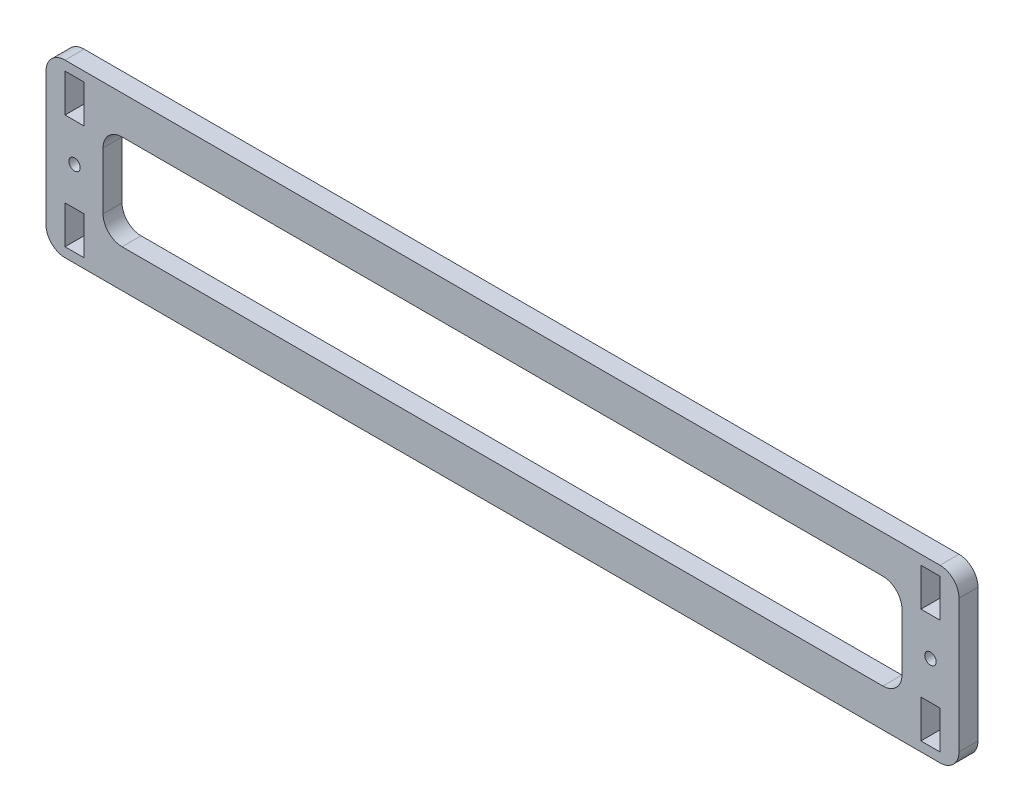
from build123d import *

# Parameters (mm, degrees)
SKETCH1_W               = 240
SKETCH1_H               = 45
SKETCH1_R               = 1.5
SKETCH1_W_2             = 5
SKETCH1_H_2             = 10
BOSS_EXTRUDE1_DEPTH     = 5
ESQUISSE1_W             = 210
ESQUISSE1_H             = 25
ENL_V_MAT_EXTRU_1_DEPTH = 10
CONG_1_R                = 5


with BuildPart() as part:
    # Sketch1 → Boss-Extrude1 (new body)
    with BuildSketch(Plane.XY):
        with Locations((34.186746988, 0)):
            Rectangle(SKETCH1_W, SKETCH1_H)
        with Locations((-78.313253012, 0)):
            Circle(SKETCH1_R, mode=Mode.SUBTRACT)
        with Locations(Location((146.686746988, 0, 0), (0, 0, 180))):
            Circle(SKETCH1_R, mode=Mode.SUBTRACT)
        with Locations((-78.313253012, -15)):
            Rectangle(SKETCH1_W_2, SKETCH1_H_2, mode=Mode.SUBTRACT)
        with Locations((-78.313253012, 15)):
            Rectangle(SKETCH1_W_2, SKETCH1_H_2, mode=Mode.SUBTRACT)
        with Locations((146.686746988, -15)):
            Rectangle(SKETCH1_W_2, SKETCH1_H_2, mode=Mode.SUBTRACT)
        with Locations((146.686746988, 15)):
            Rectangle(SKETCH1_W_2, SKETCH1_H_2, mode=Mode.SUBTRACT)
    extrude(amount=BOSS_EXTRUDE1_DEPTH)

    # Esquisse1 → Enlèv. mat.-Extru.1 (cut)
    with BuildSketch(Plane.XY.offset(5)):
        with Locations((34.186746988, 0)):
            Rectangle(ESQUISSE1_W, ESQUISSE1_H)
    extrude(amount=-ENL_V_MAT_EXTRU_1_DEPTH, mode=Mode.SUBTRACT)

    # Congé1
    cong_1_edges = [part.edges().sort_by_distance(p)[0] for p in [
        (-85.813253012, 22.5, 2.5),
        (154.186746988, 22.5, 2.5),
        (154.186746988, -22.5, 2.5),
        (-85.813253012, -22.5, 2.5),
        (-70.813253012, -12.5, 2.5),
        (-70.813253012, 12.5, 2.5),
        (139.186746988, 12.5, 2.5),
        (139.186746988, -12.5, 2.5),
    ]]
    fillet(cong_1_edges, radius=CONG_1_R)


solid = part.part
